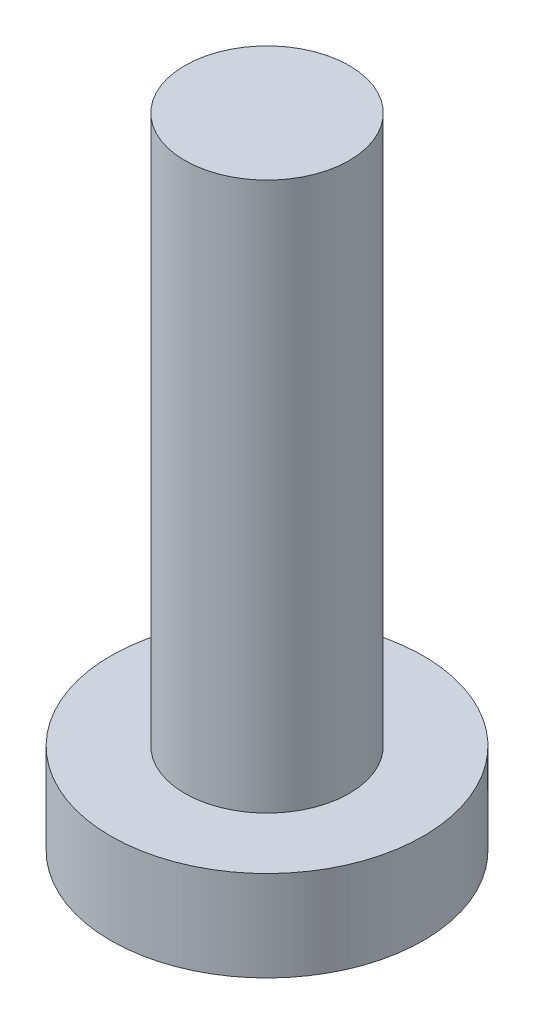
from build123d import *

# Parameters (mm, degrees)
SKETCH_1_R      = 2.85
EXTRUDE_1_DEPTH = 1.65
SKETCH_2_R      = 1.5
EXTRUDE_2_DEPTH = 10


with BuildPart() as part:
    # 草图1 → 凸台-拉伸1 (new body)
    with BuildSketch(Plane(origin=(0, 0, 0), x_dir=(1, 0, 0), z_dir=(0, 1, 0))):
        with Locations(Location((0, 0, 0), (0, 0, 270))):
            Circle(SKETCH_1_R)
    extrude(amount=EXTRUDE_1_DEPTH)

    # 草图2 → 凸台-拉伸2 (add)
    with BuildSketch(Plane(origin=(0, 1.65, 0), x_dir=(1, 0, 0), z_dir=(0, 1, 0))):
        with Locations(Location((0, 0, 0), (0, 0, 270))):
            Circle(SKETCH_2_R)
    extrude(amount=EXTRUDE_2_DEPTH)


solid = part.part
